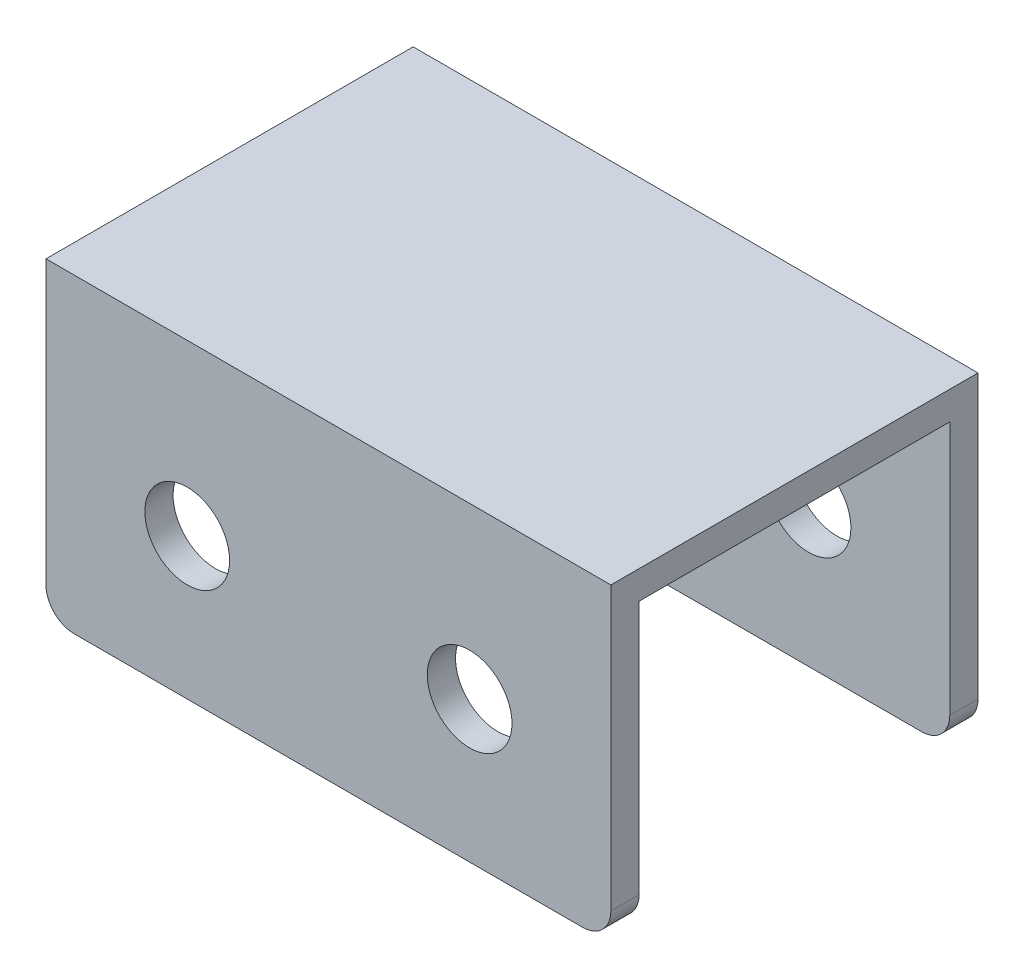
from build123d import *

# Parameters (mm, degrees)
EXTRUDE_THIN1_DEPTH     = 50
CUT_EXTRUDE1_DEPTH      = 78.821912081
CUT_EXTRUDE1_DEPTH_BACK = 78.821912081
SKETCH2_R               = 7.5
FILLET1_R               = 5


with BuildPart() as part:
    # Sketch1 → Extrude-Thin1 (new, symmetric)
    with BuildSketch(Plane(origin=(0, 0, 0), x_dir=(0, 0, -1), z_dir=(1, 0, 0))):
        Polygon((-27.5, -50), (-27.5, 0), (27.5, 0), (27.5, -50), (32.5, -50), (32.5, 5), (-32.5, 5), (-32.5, -50), align=None)
    extrude(amount=EXTRUDE_THIN1_DEPTH, both=True)

    # Sketch2 → Cut-Extrude1 (cut, two sides: drawn at the far end of the back side and taken through both)
    with BuildSketch(Plane.XY.offset(-CUT_EXTRUDE1_DEPTH_BACK)):
        with Locations((-25, -25)):
            Circle(SKETCH2_R)
        with Locations((25, -25)):
            Circle(SKETCH2_R)
    extrude(amount=CUT_EXTRUDE1_DEPTH + CUT_EXTRUDE1_DEPTH_BACK, mode=Mode.SUBTRACT)

    # Fillet1
    fillet1_edges = [part.edges().sort_by_distance(p)[0] for p in [
        (50, -50, 30),
        (50, -50, -30),
        (-50, -50, 30),
        (-50, -50, -30),
    ]]
    fillet(fillet1_edges, radius=FILLET1_R)


solid = part.part
